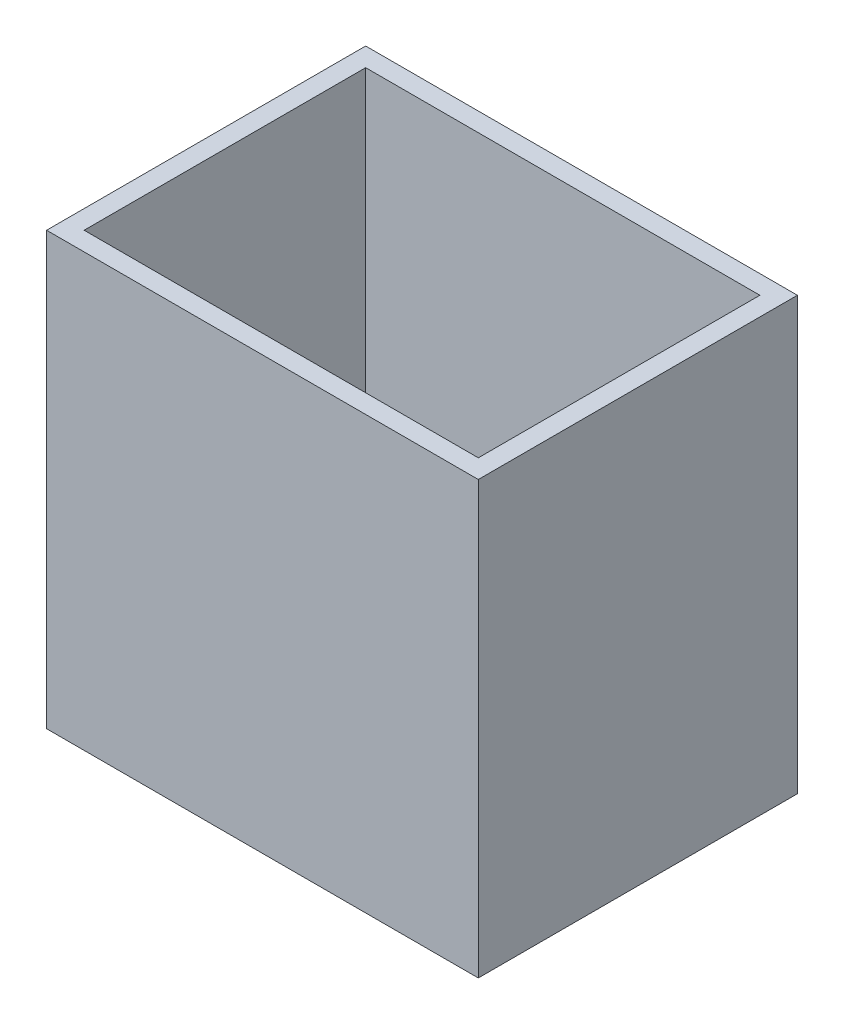
from build123d import *

# Parameters (mm, degrees)
BOSS_EXTRUDE1_START = -17
SKETCH1_W           = 46
SKETCH1_H           = 46
BOSS_EXTRUDE1_DEPTH = 34
BOSS_EXTRUDE2_START = -15
SKETCH2_W           = 42
SKETCH2_H           = 48
BOSS_EXTRUDE2_DEPTH = 30


with BuildPart() as part:
    # Sketch1 → Boss-Extrude1 (new body)
    with BuildSketch(Plane.XY.offset(BOSS_EXTRUDE1_START)):
        with Locations((0, 23)):
            Rectangle(SKETCH1_W, SKETCH1_H)
    extrude(amount=BOSS_EXTRUDE1_DEPTH)


with BuildPart() as body_2:
    # Sketch2 → Boss-Extrude2 (new body)
    with BuildSketch(Plane.XY.offset(BOSS_EXTRUDE2_START)):
        with Locations((0, 23)):
            Rectangle(SKETCH2_W, SKETCH2_H)
    extrude(amount=BOSS_EXTRUDE2_DEPTH)


with BuildPart() as part_1:
    add(part.part)

    # Combine1: cut body 2
    add(body_2.part, mode=Mode.SUBTRACT)


solid = part_1.part
